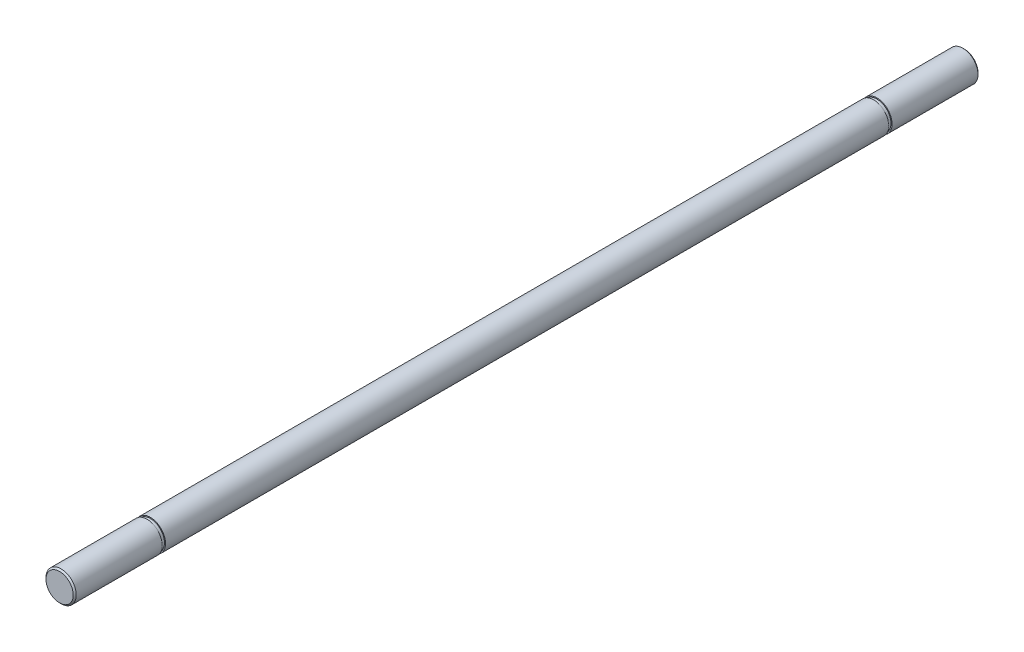
from build123d import *

# Parameters (mm, degrees)
SKETCH_1_R      = 5
EXTRUDE_1_DEPTH = 149.5
SKETCH_2_W      = 6.02158192
SKETCH_2_H      = 1.1
CHAMFER_1_SIZE  = 0.5


with BuildPart() as part:
    # 草图1 → 拉伸1 (new, symmetric)
    with BuildSketch(Plane.XY):
        Circle(SKETCH_1_R)
    extrude(amount=EXTRUDE_1_DEPTH, both=True)

    # 草图2 → 切除-旋转1 (revolve, cut)
    with BuildSketch(Plane(origin=(0, 0, 0), x_dir=(1, 0, 0), z_dir=(0, 1, 0))):
        with Locations((7.66079096, 120.05)):
            Rectangle(SKETCH_2_W, SKETCH_2_H)
        with Locations((7.66079096, -120.05)):
            Rectangle(SKETCH_2_W, SKETCH_2_H)
    revolve(axis=Axis((0, 0, 149.5), (0, 0, -1)), mode=Mode.SUBTRACT)

    # 倒角1
    chamfer_1_edges = [part.edges().sort_by_distance(p)[0] for p in [
        (-5, 0, -149.5),
        (-5, 0, 149.5),
    ]]
    chamfer(chamfer_1_edges, length=CHAMFER_1_SIZE)


solid = part.part
